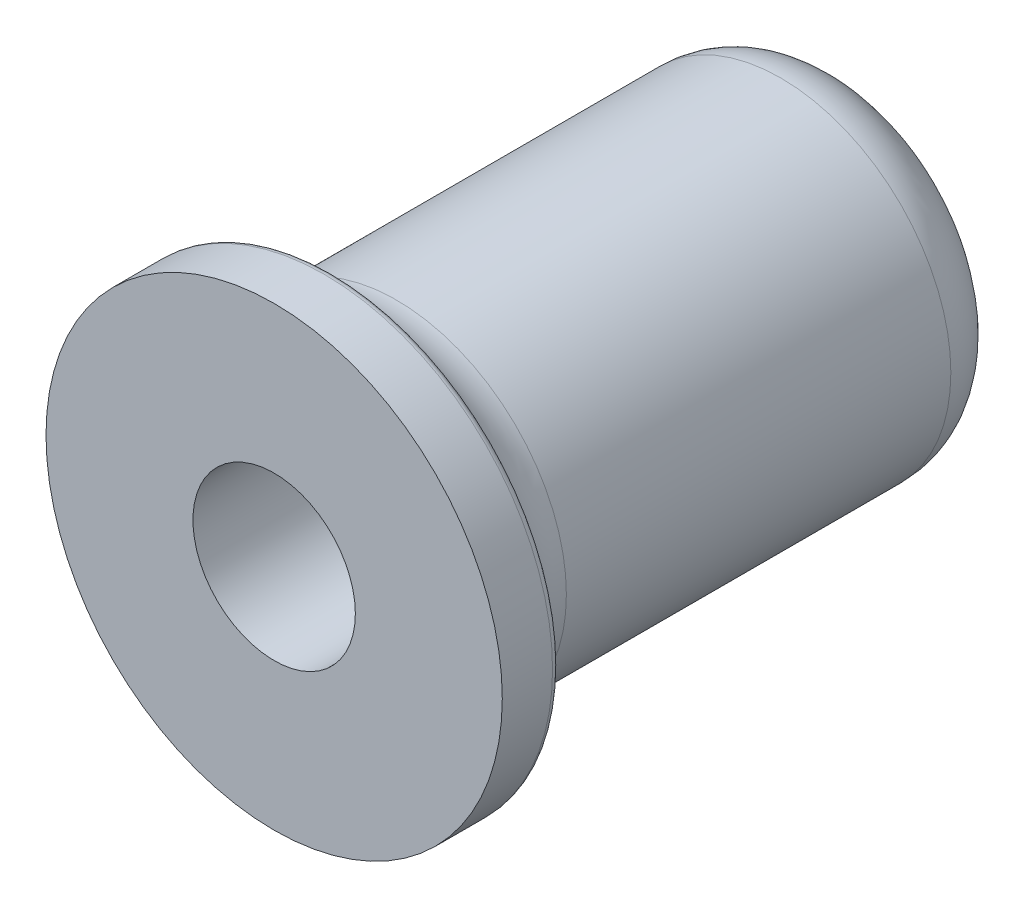
from build123d import *

# Parameters (mm, degrees)
CROQUIS1_W            = 5.9
CROQUIS1_H            = 14.8
CROQUIS2_R            = 2.1
CORTAR_EXTRUIR2_DEPTH = 13
CROQUIS23_W           = 1.5
CROQUIS23_H           = 13.3
REDONDEO1_R           = 0.2
REDONDEO2_R           = 1.7
REDONDEO3_R           = 1.7


with BuildPart() as part:
    # Croquis1 → Revolución1 (revolve)
    with BuildSketch(Plane(origin=(0, 0, 0), x_dir=(1, 0, 0), z_dir=(0, 1, 0))):
        with Locations((2.95, 7.4)):
            Rectangle(CROQUIS1_W, CROQUIS1_H)
    revolve(axis=Axis((0, 0, 0), (0, 0, -1)))

    # Croquis2 → Cortar-Extruir2 (cut)
    with BuildSketch(Plane.XY):
        Circle(CROQUIS2_R)
    extrude(amount=-CORTAR_EXTRUIR2_DEPTH, mode=Mode.SUBTRACT)

    # Croquis23 → Cortar-Revolución2 (revolve, cut)
    with BuildSketch(Plane(origin=(0, 0, 0), x_dir=(1, 0, 0), z_dir=(0, 1, 0))):
        with Locations((5.15, 8.15)):
            Rectangle(CROQUIS23_W, CROQUIS23_H)
    revolve(axis=Axis((0, 0, -1.5), (0, 0, -1)), mode=Mode.SUBTRACT)

    # Redondeo1
    redondeo1_edges = [part.edges().sort_by_distance(p)[0] for p in [
        (-5.9, 0, -1.5),
    ]]
    fillet(redondeo1_edges, radius=REDONDEO1_R)

    # Redondeo2
    redondeo2_edges = [part.edges().sort_by_distance(p)[0] for p in [
        (-4.4, 0, -14.8),
    ]]
    fillet(redondeo2_edges, radius=REDONDEO2_R)

    # Redondeo3
    redondeo3_edges = [part.edges().sort_by_distance(p)[0] for p in [
        (-4.4, 0, -1.5),
    ]]
    fillet(redondeo3_edges, radius=REDONDEO3_R)


solid = part.part
